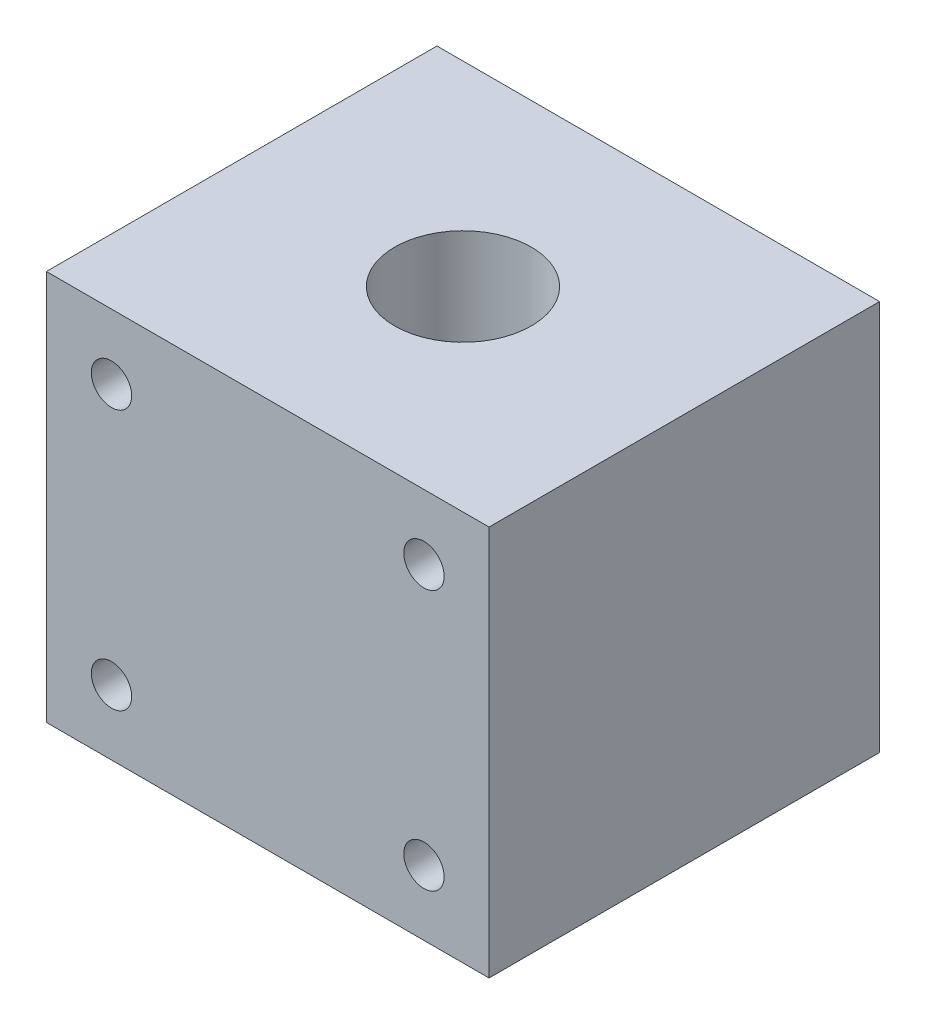
from build123d import *

# Parameters (mm, degrees)
SKETCH1_W           = 34
SKETCH1_H           = 30
SKETCH1_R           = 5.25
BOSS_EXTRUDE1_DEPTH = 30
SKETCH2_R           = 1.25
CUT_EXTRUDE1_DEPTH  = 10
SKETCH3_R           = 1.55
CUT_EXTRUDE2_DEPTH  = 10


with BuildPart() as part:
    # Sketch1 → Boss-Extrude1 (new body)
    with BuildSketch(Plane(origin=(0, 0, 0), x_dir=(1, 0, 0), z_dir=(0, 1, 0))):
        with Locations((17, -15)):
            Rectangle(SKETCH1_W, SKETCH1_H)
        with Locations(Location((17, -15, 0), (0, 0, 270))):
            Circle(SKETCH1_R, mode=Mode.SUBTRACT)
    extrude(amount=BOSS_EXTRUDE1_DEPTH)

    # Sketch2 → Cut-Extrude1 (cut)
    with BuildSketch(Plane.XZ):
        with Locations(Location((17, 23, 0), (0, 0, 270))):
            Circle(SKETCH2_R)
        with Locations(Location((25, 15, 0), (0, 0, 270))):
            Circle(SKETCH2_R)
        with Locations(Location((17, 7, 0), (0, 0, 270))):
            Circle(SKETCH2_R)
        with Locations(Location((9, 15, 0), (0, 0, 270))):
            Circle(SKETCH2_R)
    extrude(amount=-CUT_EXTRUDE1_DEPTH, mode=Mode.SUBTRACT)

    # Sketch3 → Cut-Extrude2 (cut)
    with BuildSketch(Plane.XY.offset(30)):
        with Locations((5, 25)):
            Circle(SKETCH3_R)
        with Locations((29, 25)):
            Circle(SKETCH3_R)
        with Locations((29, 5)):
            Circle(SKETCH3_R)
        with Locations((5, 5)):
            Circle(SKETCH3_R)
    extrude(amount=-CUT_EXTRUDE2_DEPTH, mode=Mode.SUBTRACT)


solid = part.part
